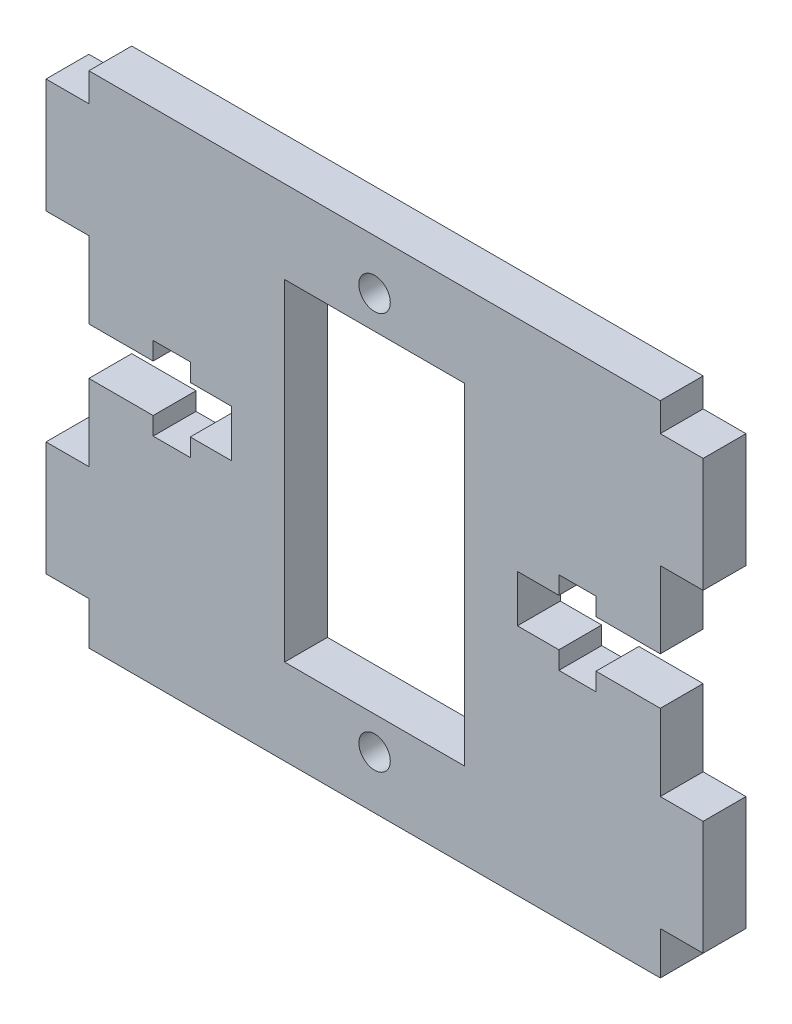
from build123d import *

# Parameters (mm, degrees)
ESKIZ_KONTUR_W        = 12.6
ESKIZ_KONTUR_H        = 23.2
PLASTINA_DEPTH        = 3
OTVERSTIYA_DEPTH      = 33.664965942
OTVERSTIYA_DEPTH_BACK = 33.664965942
ESKIZ_OTVERSTIYA_R    = 1.1


with BuildPart() as part:
    # Eskiz_kontur → Plastina (new body)
    with BuildSketch(Plane.XY):
        Polygon((20, -3.35), (15.5, -3.35), (15.5, -2.1), (12.9, -2.1), (12.9, -3.35), (10, -3.35), (10, -6.65), (12.9, -6.65), (12.9, -7.9), (15.5, -7.9), (15.5, -6.65), (20, -6.65), (20, -12), (23, -12), (23, -20), (20, -20), (20, -23), (-20, -23), (-20, -20), (-23, -20), (-23, -12), (-20, -12), (-20, -6.65), (-15.5, -6.65), (-15.5, -7.9), (-12.9, -7.9), (-12.9, -6.65), (-10, -6.65), (-10, -3.35), (-12.9, -3.35), (-12.9, -2.1), (-15.5, -2.1), (-15.5, -3.35), (-20, -3.35), (-20, 2), (-23, 2), (-23, 10), (-20, 10), (-20, 12), (20, 12), (20, 10), (23, 10), (23, 2), (20, 2), align=None)
        with Locations((0, -5.4)):
            Rectangle(ESKIZ_KONTUR_W, ESKIZ_KONTUR_H, mode=Mode.SUBTRACT)
    extrude(amount=PLASTINA_DEPTH)

    # Eskiz_otverstiya → Otverstiya (cut, two sides: drawn at the far end of the back side and taken through both)
    with BuildSketch(Plane.XY.offset(-OTVERSTIYA_DEPTH_BACK)):
        with Locations((0, -19.3)):
            Circle(ESKIZ_OTVERSTIYA_R)
        with Locations((0, 8.5)):
            Circle(ESKIZ_OTVERSTIYA_R)
    extrude(amount=OTVERSTIYA_DEPTH + OTVERSTIYA_DEPTH_BACK, mode=Mode.SUBTRACT)


solid = part.part
